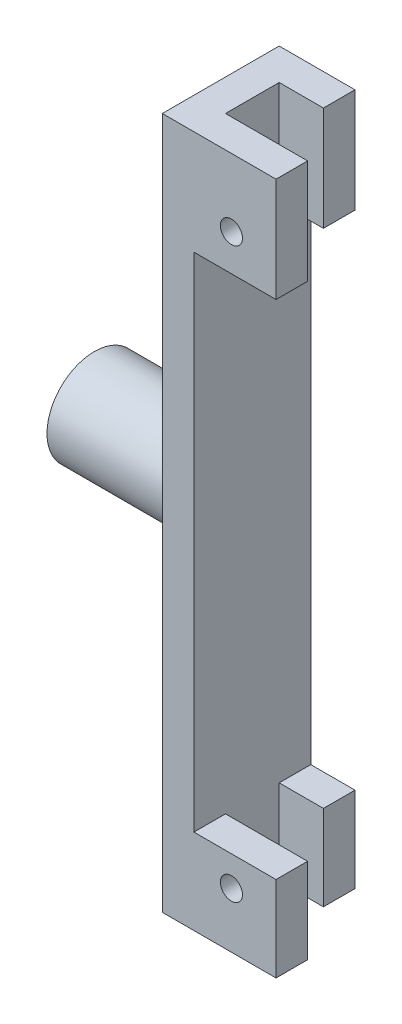
from build123d import *

# Parameters (mm, degrees)
SKETCH_1_W           = 36
SKETCH_1_H           = 219
EXTRUDE_1_DEPTH      = 37
SKETCH_2_W           = 80.767995678
SKETCH_2_H           = 159
CUT_EXTRUDE_1_DEPTH  = 117.975424769
CUT_EXTRUDE_START    = 10
SKETCH_9_W           = 26
SKETCH_9_H           = 219
CUT_EXTRUDE_7_DEPTH  = 17
SKETCH_10_W          = 12
SKETCH_10_H          = 236
CUT_EXTRUDE_8_DEPTH  = 17
CUT_EXTRUDE_START_2  = 37
SKETCH_11_R          = 3.5
CUT_EXTRUDE_11_DEPTH = 17
SKETCH_25_R          = 15
EXTRUDE_3_DEPTH      = 40


with BuildPart() as part:
    # 스케치1 → 보스-돌출1 (new body)
    with BuildSketch(Plane.XY):
        Rectangle(SKETCH_1_W, SKETCH_1_H)
    extrude(amount=EXTRUDE_1_DEPTH)

    # 스케치2 → 컷-돌출1 (cut, through all)
    with BuildSketch(Plane.XY):
        with Locations((32.383997839, -3)):
            Rectangle(SKETCH_2_W, SKETCH_2_H)
    extrude(amount=CUT_EXTRUDE_1_DEPTH, mode=Mode.SUBTRACT)

    # 스케치9 → 컷-돌출7 (cut)
    with BuildSketch(Plane.XY.offset(CUT_EXTRUDE_START)):
        with Locations((5, 0)):
            Rectangle(SKETCH_9_W, SKETCH_9_H)
    extrude(amount=CUT_EXTRUDE_7_DEPTH, mode=Mode.SUBTRACT)

    # 스케치10 → 컷-돌출8 (cut)
    with BuildSketch(Plane.XY):
        with Locations((12, 8.5)):
            Rectangle(SKETCH_10_W, SKETCH_10_H)
    extrude(amount=CUT_EXTRUDE_8_DEPTH, mode=Mode.SUBTRACT)

    # 스케치11 → 컷-돌출11 (cut)
    with BuildSketch(Plane.XY.offset(CUT_EXTRUDE_START_2)):
        with Locations((3.878169626, 88)):
            Circle(SKETCH_11_R)
        with Locations((3.878169626, -92)):
            Circle(SKETCH_11_R)
    extrude(amount=-CUT_EXTRUDE_11_DEPTH, mode=Mode.SUBTRACT)

    # 스케치25 → 보스-돌출3 (add)
    with BuildSketch(Plane.ZY.offset(18)):
        with Locations(Location((18.5, 0, 0), (0, 0, 180))):
            Circle(SKETCH_25_R)
    extrude(amount=EXTRUDE_3_DEPTH)


solid = part.part
